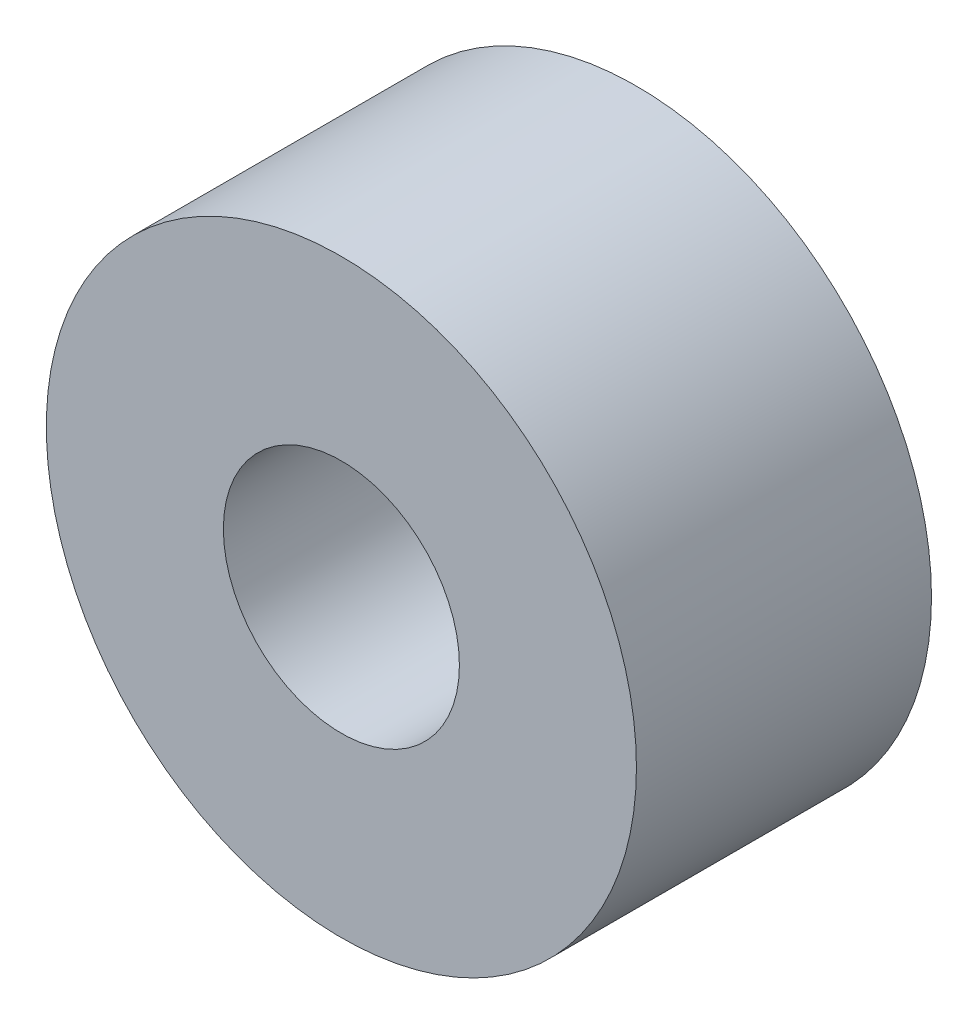
from build123d import *

# Parameters (mm, degrees)
CROQUIS1_R              = 4
CROQUIS1_R_2            = 1.6
SALIENTE_EXTRUIR1_DEPTH = 4


with BuildPart() as part:
    # Croquis1 → Saliente-Extruir1 (new body)
    with BuildSketch(Plane.XY):
        Circle(CROQUIS1_R)
        Circle(CROQUIS1_R_2, mode=Mode.SUBTRACT)
    extrude(amount=SALIENTE_EXTRUIR1_DEPTH)


solid = part.part
